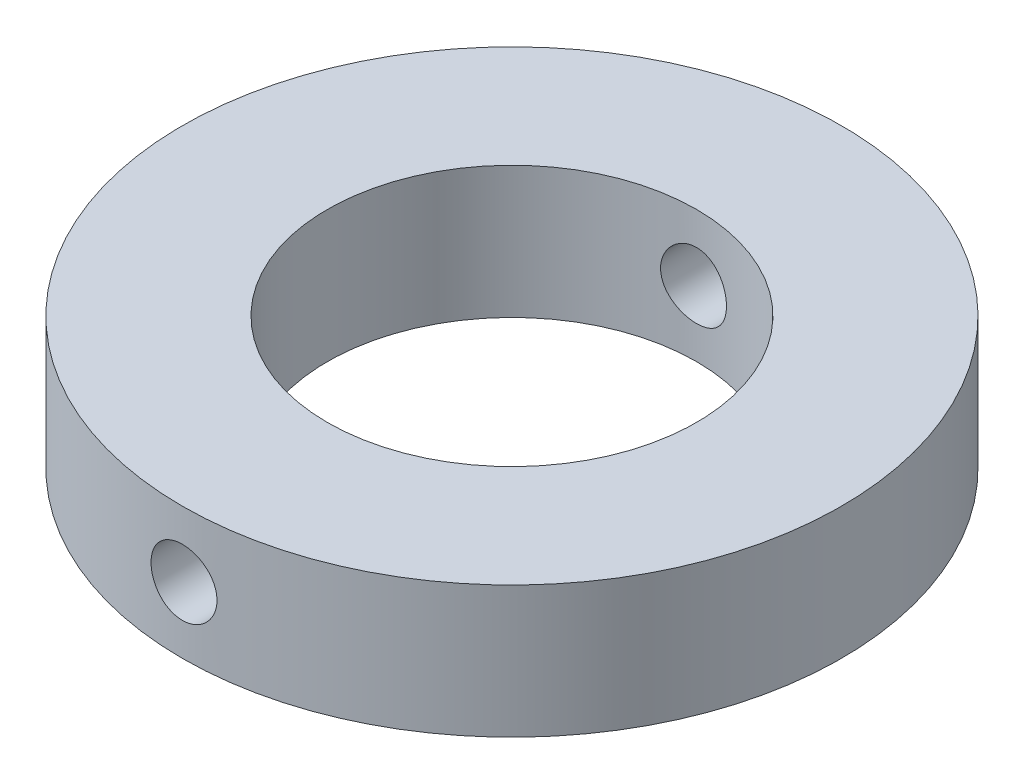
from build123d import *

# Parameters (mm, degrees)
SKETCH1_R           = 25
SKETCH1_R_2         = 14
BOSS_EXTRUDE1_DEPTH = 5
SKETCH2_R           = 2.5
CUT_EXTRUDE1_DEPTH  = 35


with BuildPart() as part:
    # Sketch1 → Boss-Extrude1 (new, symmetric)
    with BuildSketch(Plane(origin=(0, 0, 0), x_dir=(1, 0, 0), z_dir=(0, 1, 0))):
        with Locations(Location((0, 0, 0), (0, 0, 270))):
            Circle(SKETCH1_R)
        with Locations(Location((0, 0, 0), (0, 0, 270))):
            Circle(SKETCH1_R_2, mode=Mode.SUBTRACT)
    extrude(amount=BOSS_EXTRUDE1_DEPTH, both=True)

    # Sketch2 → Cut-Extrude1 (cut, symmetric)
    with BuildSketch(Plane.XY):
        Circle(SKETCH2_R)
    extrude(amount=CUT_EXTRUDE1_DEPTH, both=True, mode=Mode.SUBTRACT)


solid = part.part
